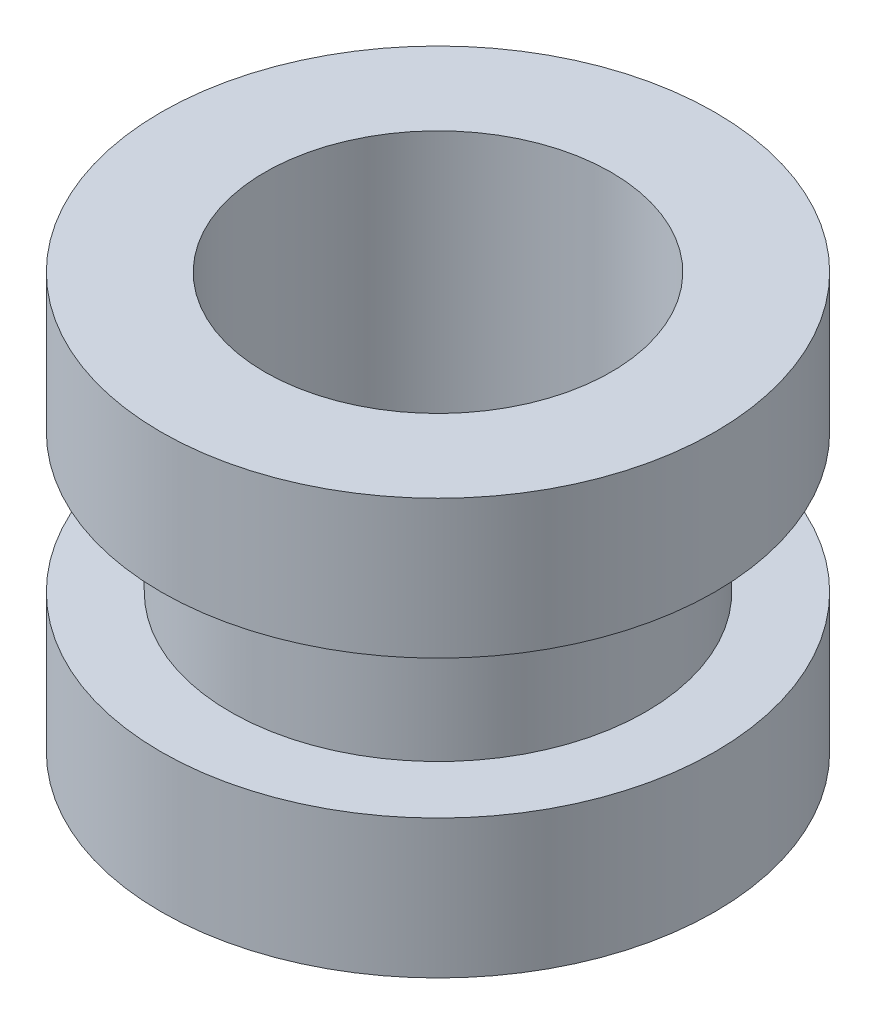
from build123d import *

# Parameters (mm, degrees)
SKETCH2_R          = 3.175
CUT_EXTRUDE1_DEPTH = 11.472688289


with BuildPart() as part:
    # Sketch1 → Revolve1 (revolve)
    with BuildSketch(Plane.XY):
        Polygon((0, 0), (5.08, 0), (5.08, 2.54), (3.81, 2.54), (3.81, 5.08), (5.08, 5.08), (5.08, 7.62), (0, 7.62), align=None)
    revolve(axis=Axis((0, 0, 0), (0, 1, 0)))

    # Sketch2 → Cut-Extrude1 (cut, through all)
    with BuildSketch(Plane(origin=(0, 7.62, 0), x_dir=(1, 0, 0), z_dir=(0, 1, 0))):
        with Locations(Location((0, 0, 0), (0, 0, 270))):
            Circle(SKETCH2_R)
    extrude(amount=-CUT_EXTRUDE1_DEPTH, mode=Mode.SUBTRACT)


solid = part.part
